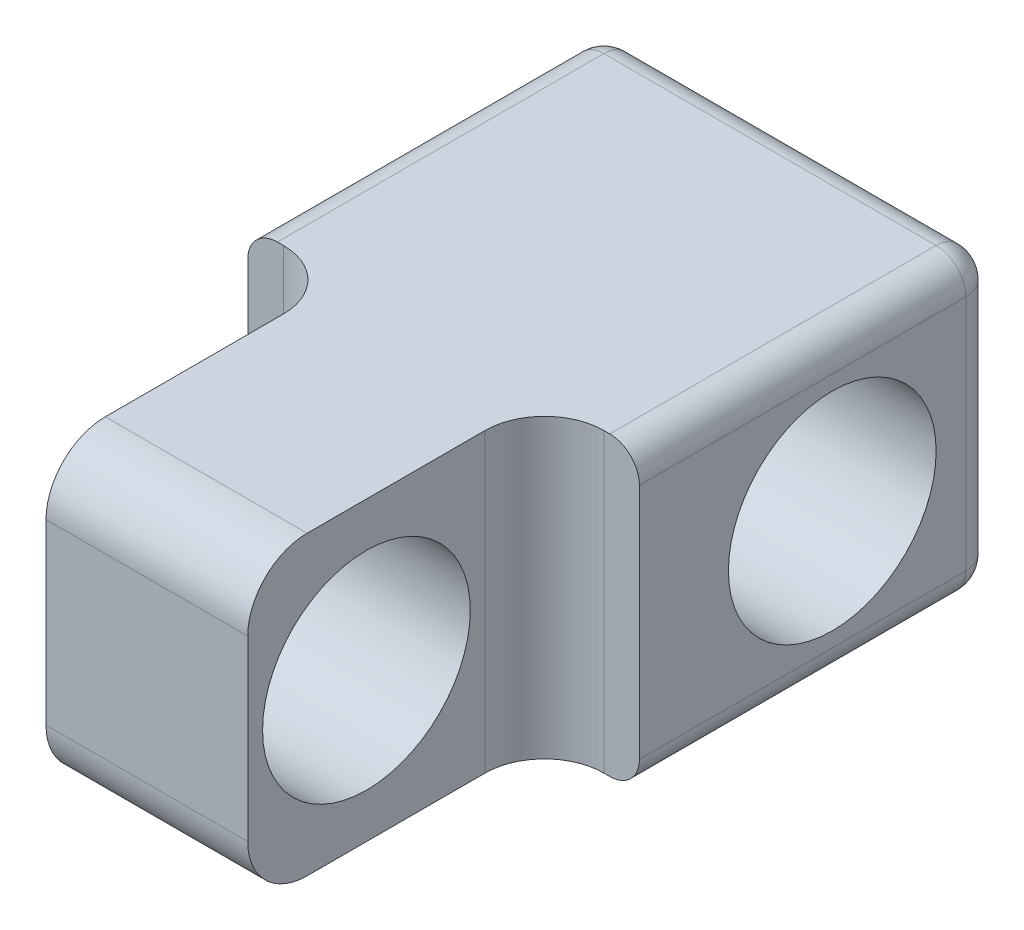
from build123d import *

# Parameters (mm, degrees)
BOSS_EXTRUDE1_DEPTH = 6
SKETCH2_R           = 1.75
CUT_EXTRUDE1_DEPTH  = 6.6
FILLET1_R           = 0.5
SKETCH3_W           = 3.4
SKETCH3_H           = 5
BOSS_EXTRUDE2_DEPTH = 5
FILLET2_R           = 1
SKETCH5_R           = 1.75
CUT_EXTRUDE2_DEPTH  = 4
FILLET3_R           = 1


with BuildPart() as part:
    # Sketch1 → Boss-Extrude1 (new body)
    with BuildSketch(Plane.XY):
        with BuildLine():
            Line((0.5, 0), (6.1, 0))
            ThreePointArc((6.1, 0), (6.453553391, 0.146446609), (6.6, 0.5))
            Line((6.6, 0.5), (6.6, 4.5))
            ThreePointArc((6.6, 4.5), (6.453553391, 4.853553391), (6.1, 5))
            Line((6.1, 5), (0.5, 5))
            ThreePointArc((0.5, 5), (0.146446609, 4.853553391), (0, 4.5))
            Line((0, 4.5), (0, 0.5))
            ThreePointArc((0, 0.5), (0.146446609, 0.146446609), (0.5, 0))
        make_face()
    extrude(amount=BOSS_EXTRUDE1_DEPTH)

    # Sketch2 → Cut-Extrude1 (cut)
    with BuildSketch(Plane(origin=(6.6, 0, 0), x_dir=(0, 0, -1), z_dir=(1, 0, 0))):
        with Locations((-2.75, 2.5)):
            Circle(SKETCH2_R)
    extrude(amount=-CUT_EXTRUDE1_DEPTH, mode=Mode.SUBTRACT)

    # Fillet1
    fillet1_edges = [part.edges().sort_by_distance(p)[0] for p in [
        (0, 2.5, 0),
        (0.146446609, 4.853553391, 0),
        (3.3, 5, 0),
        (6.453553391, 4.853553391, 0),
        (6.6, 2.5, 0),
        (6.453553391, 0.146446609, 0),
        (3.3, 0, 0),
        (0.146446609, 0.146446609, 0),
    ]]
    fillet(fillet1_edges, radius=FILLET1_R)

    # Sketch3 → Boss-Extrude2 (add)
    with BuildSketch(Plane.XY.offset(6)):
        with Locations((3.3, 2.5)):
            Rectangle(SKETCH3_W, SKETCH3_H)
    extrude(amount=BOSS_EXTRUDE2_DEPTH)

    # Fillet2
    fillet2_edges = [part.edges().sort_by_distance(p)[0] for p in [
        (1.6, 2.5, 6),
        (5, 2.5, 6),
    ]]
    fillet(fillet2_edges, radius=FILLET2_R)

    # Sketch5 → Cut-Extrude2 (cut)
    with BuildSketch(Plane(origin=(5, 0, 0), x_dir=(0, 0, -1), z_dir=(1, 0, 0))):
        with Locations(Location((-9, 2.5, 0), (0, 0, 90))):
            Circle(SKETCH5_R)
    extrude(amount=-CUT_EXTRUDE2_DEPTH, mode=Mode.SUBTRACT)

    # Fillet3
    fillet3_edges = [part.edges().sort_by_distance(p)[0] for p in [
        (3.3, 5, 11),
        (3.3, 0, 11),
    ]]
    fillet(fillet3_edges, radius=FILLET3_R)


solid = part.part
